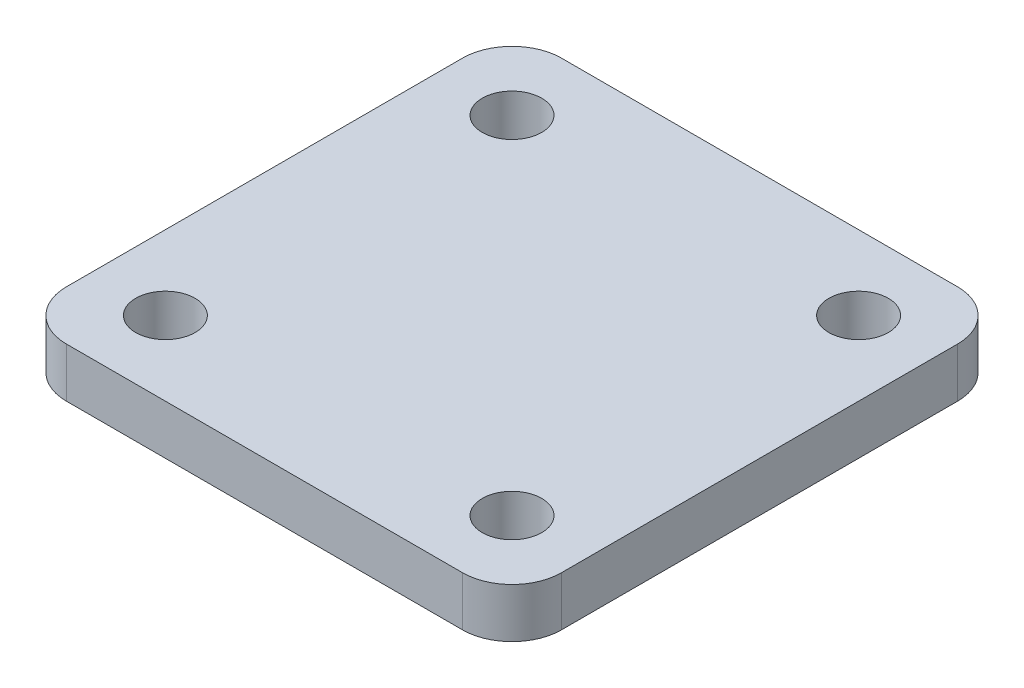
from build123d import *

# Parameters (mm, degrees)
SCHIZZO1_W                   = 100
SCHIZZO1_H                   = 100
SCHIZZO1_R                   = 6
ESTRUSIONE_ESTRUSIONE1_DEPTH = 10
RACCORDO1_R                  = 10


with BuildPart() as part:
    # Schizzo1 → Estrusione-Estrusione1 (new body)
    with BuildSketch(Plane(origin=(0, 0, 0), x_dir=(1, 0, 0), z_dir=(0, 1, 0))):
        Rectangle(SCHIZZO1_W, SCHIZZO1_H)
        with Locations(Location((-35, 35, 0), (0, 0, 270))):
            Circle(SCHIZZO1_R, mode=Mode.SUBTRACT)
        with Locations(Location((35, 35, 0), (0, 0, 270))):
            Circle(SCHIZZO1_R, mode=Mode.SUBTRACT)
        with Locations(Location((-35, -35, 0), (0, 0, 270))):
            Circle(SCHIZZO1_R, mode=Mode.SUBTRACT)
        with Locations(Location((35, -35, 0), (0, 0, 270))):
            Circle(SCHIZZO1_R, mode=Mode.SUBTRACT)
    extrude(amount=ESTRUSIONE_ESTRUSIONE1_DEPTH)

    # Raccordo1
    raccordo1_edges = [part.edges().sort_by_distance(p)[0] for p in [
        (-50, 5, -50),
        (50, 5, -50),
        (50, 5, 50),
        (-50, 5, 50),
    ]]
    fillet(raccordo1_edges, radius=RACCORDO1_R)


solid = part.part
